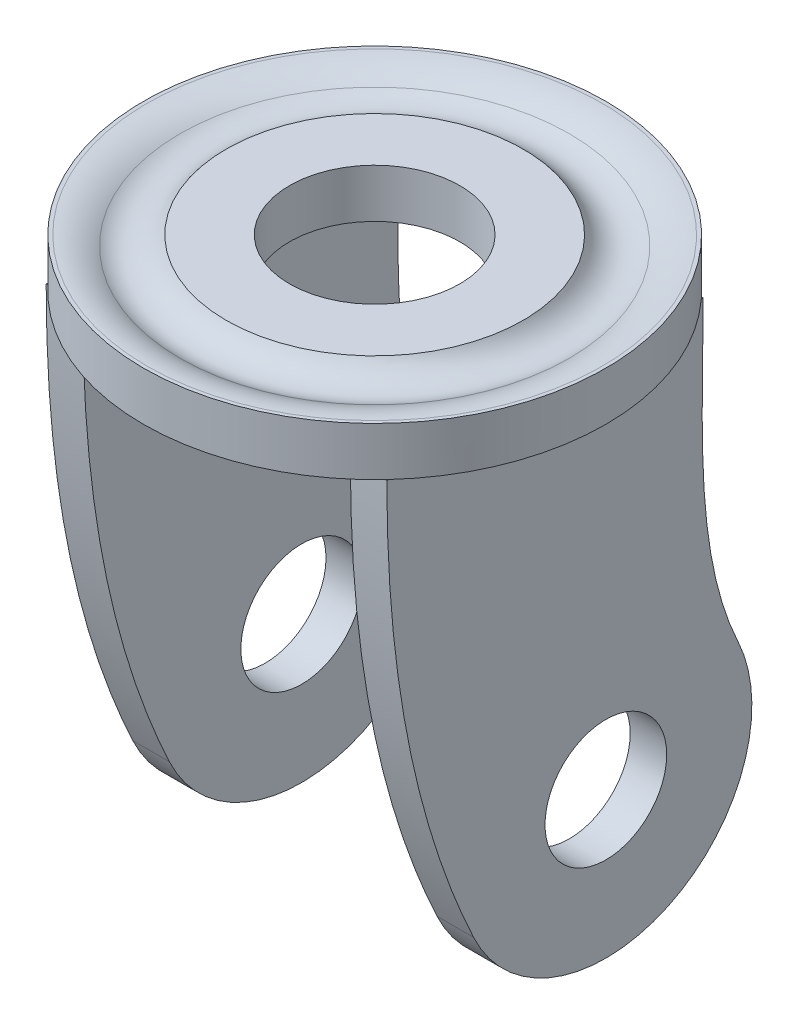
from build123d import *

# Parameters (mm, degrees)
BOSS_EXTRUDE1_START = -11
SKETCH2_R           = 5
BOSS_EXTRUDE1_DEPTH = 3
FILLET1_R           = 5


with BuildPart() as part:
    # Sketch1 → Revolve1 (revolve)
    with BuildSketch(Plane.XY, mode=Mode.PRIVATE) as revolve1_sk:
        with BuildLine():
            Line((-16.8, 4), (-19, 4))
            Line((-19, 4), (-19, 0))
            Line((-19, 0), (-7, 0))
            Line((-7, 0), (-7, 4))
            Line((-7, 4), (-12.2, 4))
            ThreePointArc((-12.2, 4), (-14.5, 2.757481343), (-16.8, 4))
        make_face()
    revolve(revolve1_sk.sketch.rotate(Axis((0, 8.369163349, 0), (0, -1, 0)), 270), axis=Axis((0, 8.369163349, 0), (0, -1, 0)))

    # Sketch2 → Boss-Extrude1 (add)
    with BuildSketch(Plane(origin=(0, 0, 0), x_dir=(0, 0, -1), z_dir=(1, 0, 0)).offset(BOSS_EXTRUDE1_START)):
        with BuildLine():
            Line((13, 0), (-13, 0))
            add(Edge.make_bspline(
                [(-5.875693444, -36.071419141), (-11.248074258, -24.550311306), (-13, -12.25607796), (-13, 0)],
                knots=[0, 0, 0, 0, 1, 1, 1, 1], degree=3))
            ThreePointArc((-5.875693444, -36.071419141), (10.071419141, -41.875693444), (15.875693444, -25.928580859))
            add(Edge.make_bspline(
                [(15.875693444, -25.928580859), (12.156143996, -17.951981325), (13, -8.695854173), (13, 0)],
                knots=[0, 0, 0, 0, 1, 1, 1, 1], degree=3))
        make_face()
        with Locations((5, -31)):
            Circle(SKETCH2_R, mode=Mode.SUBTRACT)
    boss_extrude1 = extrude(amount=-BOSS_EXTRUDE1_DEPTH)

    # Mirror1: Boss-Extrude1 across plane
    add(boss_extrude1.mirror(Plane(origin=(0, 0, 0), x_dir=(0, 0, 1), z_dir=(1, 0, 0))))

    # Fillet1
    fillet1_edges = [part.edges().sort_by_distance(p)[0] for p in [
        (0, 4, -16.8),
    ]]
    fillet(fillet1_edges, radius=FILLET1_R)


solid = part.part
